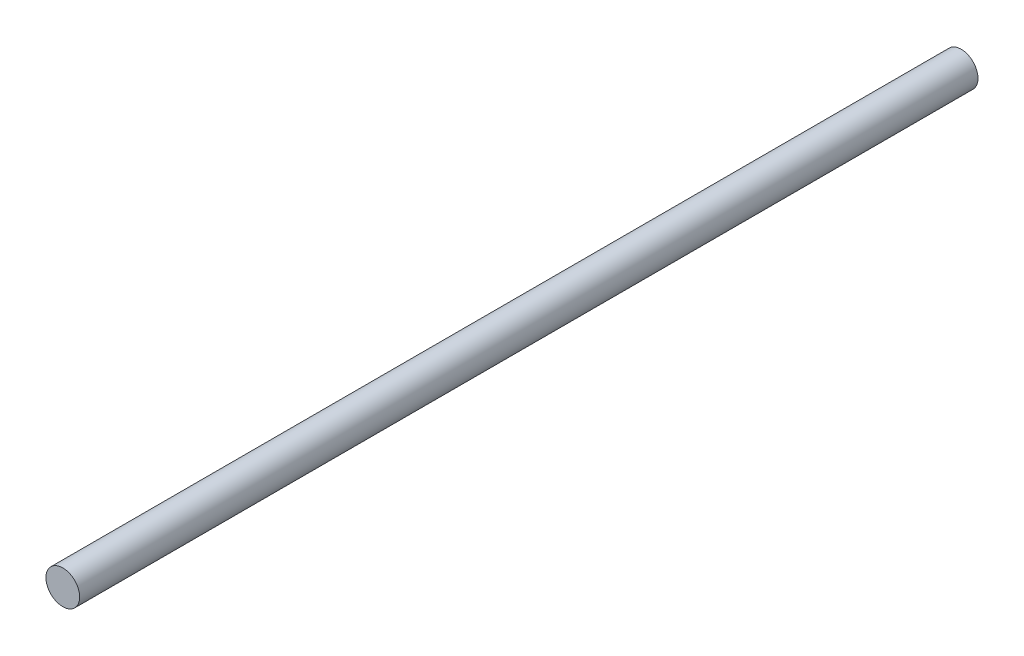
from build123d import *

# Parameters (mm, degrees)
SKETCH_1_R      = 6
EXTRUDE_1_DEPTH = 320


with BuildPart() as part:
    # Эскиз1 → Бобышка-Вытянуть1 (new body)
    with BuildSketch(Plane.XY):
        Circle(SKETCH_1_R)
    extrude(amount=EXTRUDE_1_DEPTH)


solid = part.part
